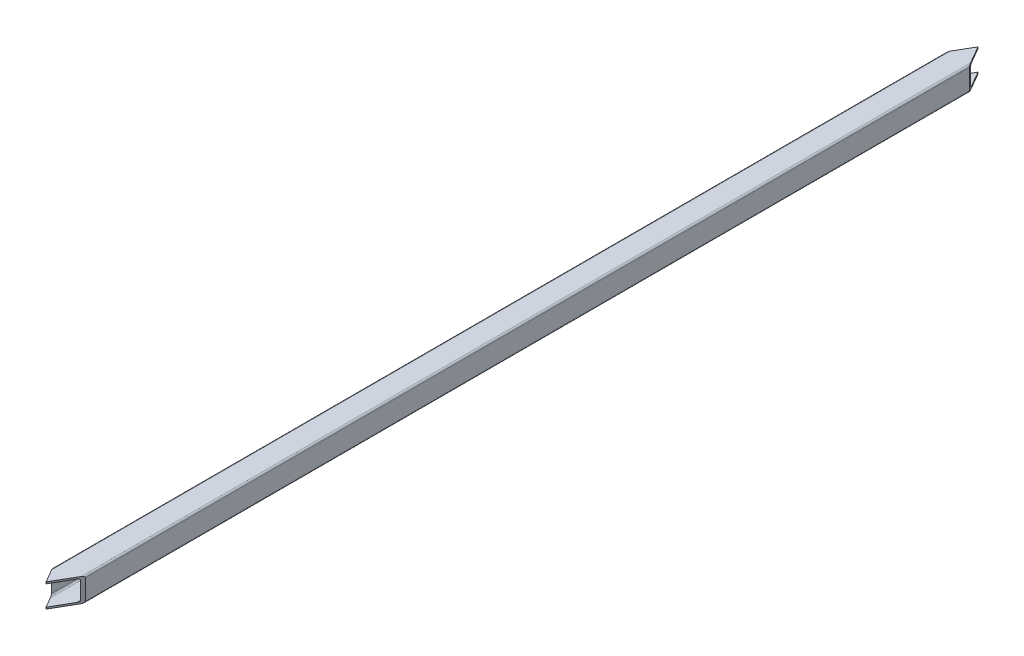
from build123d import *

# Parameters (mm, degrees)
BOSS_EXTRUDE1_DEPTH     = 1500
CUT_EXTRUDE1_DEPTH      = 1501.967428028
CUT_EXTRUDE1_DEPTH_BACK = 1501.967428028
CUT_EXTRUDE2_DEPTH      = 1501.967428028
CUT_EXTRUDE2_DEPTH_BACK = 1501.967428028


with BuildPart() as part:
    # Sketch1 → Boss-Extrude1 (new body)
    with BuildSketch(Plane.XY):
        with BuildLine():
            Line((2.54, 0), (35.56, 0))
            ThreePointArc((35.56, 0), (37.356051224, -0.743948776), (38.1, -2.54))
            Line((38.1, -2.54), (38.1, -35.56))
            ThreePointArc((38.1, -35.56), (37.356051224, -37.356051224), (35.56, -38.1))
            Line((35.56, -38.1), (2.54, -38.1))
            ThreePointArc((2.54, -38.1), (0.743948776, -37.356051224), (0, -35.56))
            Line((0, -35.56), (0, -2.54))
            ThreePointArc((0, -2.54), (0.743948776, -0.743948776), (2.54, 0))
        make_face()
        with BuildLine():
            Line((5.3086, -2.7686), (32.7914, -2.7686))
            ThreePointArc((32.7914, -2.7686), (34.587451224, -3.512548776), (35.3314, -5.3086))
            Line((35.3314, -5.3086), (35.3314, -32.7914))
            ThreePointArc((35.3314, -32.7914), (34.587451224, -34.587451224), (32.7914, -35.3314))
            Line((32.7914, -35.3314), (5.3086, -35.3314))
            ThreePointArc((5.3086, -35.3314), (3.512548776, -34.587451224), (2.7686, -32.7914))
            Line((2.7686, -32.7914), (2.7686, -5.3086))
            ThreePointArc((2.7686, -5.3086), (3.512548776, -3.512548776), (5.3086, -2.7686))
        make_face(mode=Mode.SUBTRACT)
    extrude(amount=BOSS_EXTRUDE1_DEPTH)

    # Sketch2 → Cut-Extrude1 (cut, two sides: drawn at the far end of the back side and taken through both)
    with BuildSketch(Plane(origin=(0, 0, 0), x_dir=(1, 0, 0), z_dir=(0, 1, 0)).offset(-CUT_EXTRUDE1_DEPTH_BACK)):
        Polygon((19.05, 0), (38.1, -32.995567884), (38.1, 0), align=None)
        Polygon((0, -1500), (0, -1474.287456108), (14.845144137, -1500), align=None)
    extrude(amount=CUT_EXTRUDE1_DEPTH + CUT_EXTRUDE1_DEPTH_BACK, mode=Mode.SUBTRACT)

    # Sketch3 → Cut-Extrude2 (cut, two sides: drawn at the far end of the back side and taken through both)
    with BuildSketch(Plane.XZ.offset(38.1).offset(-CUT_EXTRUDE2_DEPTH_BACK)):
        Polygon((35.56, 1500), (14.845144137, 1500), (35.56, 1464.120817175), align=None)
        Polygon((35.56, 1500), (35.56, 1464.120817175), (38.1, 1459.721408123), (38.1, 1500), align=None)
        Polygon((2.54, 0), (2.54, 28.596158833), (0, 32.995567884), (0, 0), align=None)
        Polygon((19.05, 0), (2.54, 28.596158833), (2.54, 0), align=None)
    extrude(amount=CUT_EXTRUDE2_DEPTH + CUT_EXTRUDE2_DEPTH_BACK, mode=Mode.SUBTRACT)


solid = part.part
